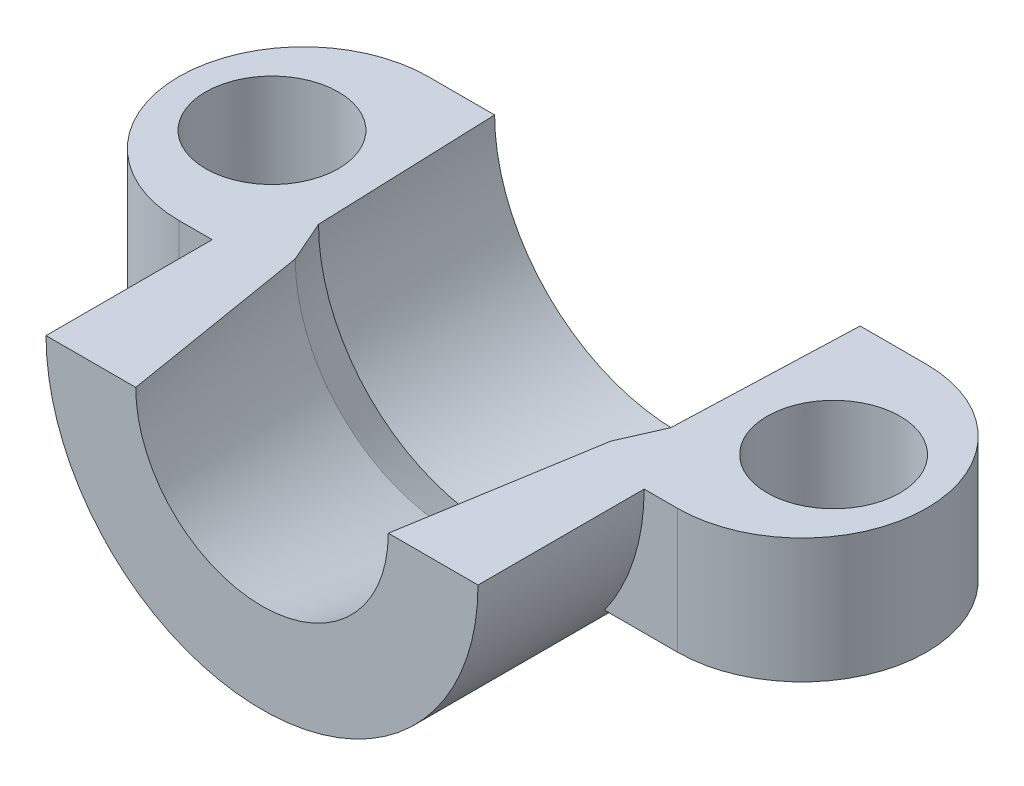
from build123d import *

# Parameters (mm, degrees)
SKETCH1_R             = 13
BOSS_EXTRUDE1_DEPTH   = 25
BOSS_EXTRUDE2_DEPTH   = 7.5
BOSS_EXTRUDE2_2_DEPTH = 7.5
BOSS_EXTRUDE3_DEPTH   = 15
SKETCH5_R             = 3
CUT_EXTRUDE1_DEPTH    = 40.389084782
SKETCH6_R             = 4.45
CUT_EXTRUDE2_DEPTH    = 3
SKETCH7_R             = 4
CUT_EXTRUDE3_DEPTH    = 7.5
SKETCH8_W             = 50
SKETCH8_H             = 50
CUT_EXTRUDE4_DEPTH    = 37.058979464


with BuildPart() as part:
    # Sketch1 → Boss-Extrude1 (new body)
    with BuildSketch(Plane.XY):
        Circle(SKETCH1_R)
    extrude(amount=-BOSS_EXTRUDE1_DEPTH)

    # Sketch2 → Cut-Revolve1 (revolve, cut)
    with BuildSketch(Plane(origin=(0, 0, 0), x_dir=(0, 0, -1), z_dir=(1, 0, 0)), mode=Mode.PRIVATE) as cut_revolve1_sk:
        Polygon((0, 0), (0, 7.6), (11.5, 9.5), (14, 10.6), (25, 11), (25, 0), align=None)
    revolve(cut_revolve1_sk.sketch.rotate(Axis((0, 0, -25), (0, 0, 1)), 90), axis=Axis((0, 0, -25), (0, 0, 1)), mode=Mode.SUBTRACT)



with BuildPart() as body_2:
    # Sketch3 → Boss-Extrude2 (new, symmetric)
    with BuildSketch(Plane(origin=(0, 0, 0), x_dir=(1, 0, 0), z_dir=(0, 1, 0))):
        with BuildLine():
            Line((-13, 25), (-13, 10))
            Line((-13, 10), (-15, 10))
            ThreePointArc((-15, 10), (-22.5, 17.5), (-15, 25))
            Line((-15, 25), (-13, 25))
        make_face()
    extrude(amount=BOSS_EXTRUDE2_DEPTH, both=True)


with BuildPart() as body_3:
    # Sketch3 → Boss-Extrude2 2 (new, symmetric)
    with BuildSketch(Plane(origin=(0, 0, 0), x_dir=(1, 0, 0), z_dir=(0, 1, 0))):
        with BuildLine():
            Line((13, 25), (15, 25))
            ThreePointArc((15, 25), (22.5, 17.5), (15, 10))
            Line((15, 10), (13, 10))
            Line((13, 10), (13, 25))
        make_face()
    extrude(amount=BOSS_EXTRUDE2_2_DEPTH, both=True)


with BuildPart() as part_1:
    add(part.part)

    add(body_2.part)  # Boss-Extrude3 merges body 2

    add(body_3.part)  # Boss-Extrude3 merges body 3
    # Sketch4 → Boss-Extrude3 (add)
    with BuildSketch(Plane(origin=(0, 0, -25), x_dir=(-1, 0, 0), z_dir=(0, 0, -1))):
        with BuildLine():
            Line((-13, 7.5), (-13, -7.5))
            Line((-13, -7.5), (-8.04673847, -7.5))
            ThreePointArc((-8.04673847, -7.5), (-11, 0), (-8.04673847, 7.5))
            Line((-8.04673847, 7.5), (-13, 7.5))
        make_face()
        with BuildLine():
            Line((13, 7.5), (13, -7.5))
            Line((13, -7.5), (8.04673847, -7.5))
            ThreePointArc((8.04673847, -7.5), (11, 0), (8.04673847, 7.5))
            Line((8.04673847, 7.5), (13, 7.5))
        make_face()
    extrude(amount=-BOSS_EXTRUDE3_DEPTH)

    # Sketch5 → Cut-Extrude1 (cut, through all)
    with BuildSketch(Plane(origin=(0, 7.5, 0), x_dir=(1, 0, 0), z_dir=(0, 1, 0))):
        with Locations(Location((16.9, 17.5, 0), (0, 0, 270))):
            Circle(SKETCH5_R)
        with Locations(Location((-16.9, 17.5, 0), (0, 0, 270))):
            Circle(SKETCH5_R)
    extrude(amount=-CUT_EXTRUDE1_DEPTH, mode=Mode.SUBTRACT)

    # Sketch6 → Cut-Extrude2 (cut)
    with BuildSketch(Plane(origin=(0, 7.5, 0), x_dir=(1, 0, 0), z_dir=(0, 1, 0))):
        with Locations(Location((-16.9, 17.5, 0), (0, 0, 270))):
            Circle(SKETCH6_R)
        with Locations(Location((16.9, 17.5, 0), (0, 0, 270))):
            Circle(SKETCH6_R)
    extrude(amount=-CUT_EXTRUDE2_DEPTH, mode=Mode.SUBTRACT)

    # Sketch7 → Cut-Extrude3 (cut)
    with BuildSketch(Plane.XZ.offset(7.5)):
        with Locations(Location((-16.9, -17.5, 0), (0, 0, 270))):
            Circle(SKETCH7_R)
        with Locations(Location((16.9, -17.5, 0), (0, 0, 270))):
            Circle(SKETCH7_R)
    extrude(amount=-CUT_EXTRUDE3_DEPTH, mode=Mode.SUBTRACT)

    # Sketch8 → Cut-Extrude4 (cut, through all)
    with BuildSketch(Plane(origin=(0, 0, 0), x_dir=(1, 0, 0), z_dir=(0, 1, 0))):
        with Locations((0, 14.017641389)):
            Rectangle(SKETCH8_W, SKETCH8_H)
    extrude(amount=CUT_EXTRUDE4_DEPTH, mode=Mode.SUBTRACT)


solid = part_1.part
